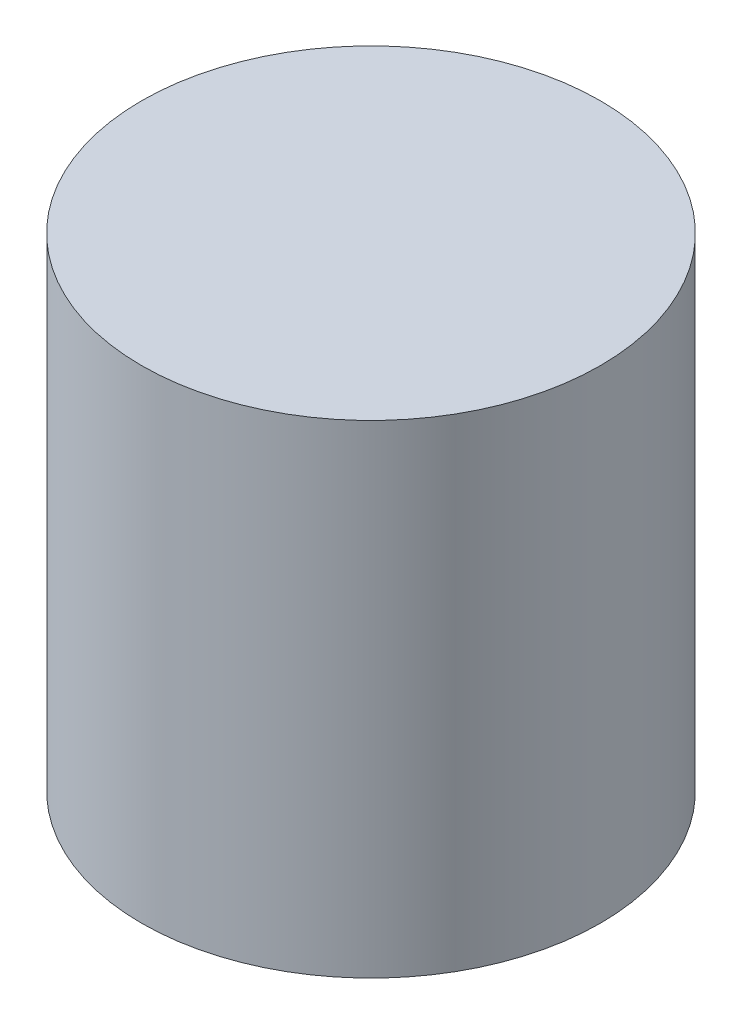
from build123d import *

# Parameters (mm, degrees)
SKETCH1_R           = 30.1625
BOSS_EXTRUDE1_DEPTH = 63.5


with BuildPart() as part:
    # Sketch1 → Boss-Extrude1 (new body)
    with BuildSketch(Plane(origin=(0, 0, 0), x_dir=(1, 0, 0), z_dir=(0, 1, 0))):
        with Locations(Location((0, 0, 0), (0, 0, 270))):
            Circle(SKETCH1_R)
    extrude(amount=BOSS_EXTRUDE1_DEPTH)


solid = part.part
